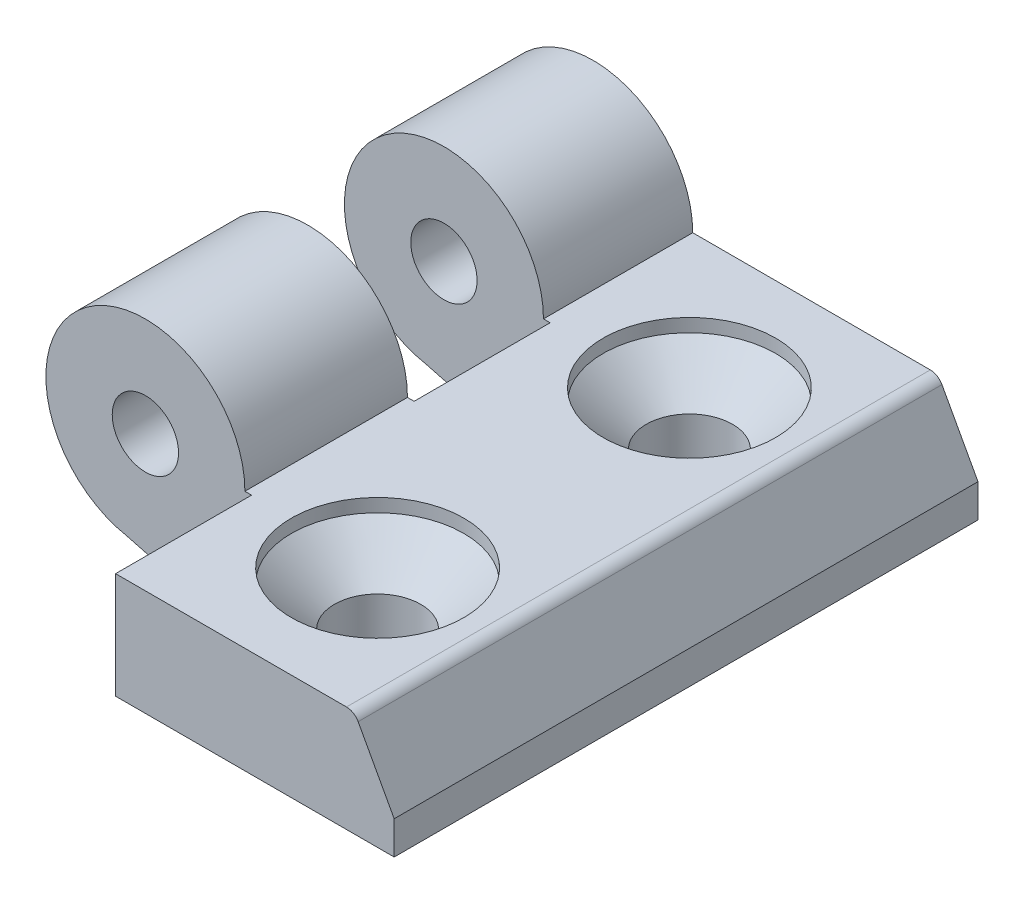
from build123d import *

# Parameters (mm, degrees)
EXTRUDE_1_DEPTH          = 22
PATTERN_LINEAR_1_COUNT   = 2
PATTERN_LINEAR_1_PITCH   = 23.5
CUT_EXTRUDE_1_DEPTH      = 38.269290307
CUT_EXTRUDE_1_DEPTH_BACK = 38.269290307
SKETCH_4_W               = 16.100903004
SKETCH_4_H               = 10.25
SKETCH_5_R               = 2.5
CUT_EXTRUDE_2_DEPTH      = 54.301031885


with BuildPart() as part:
    # 草图1 → 凸台-拉伸1 (new, symmetric)
    with BuildSketch(Plane.XY):
        with BuildLine():
            Line((29, -5.5), (29, -8))
            Line((29, -8), (1, -8))
            Line((1, -8), (-1.370141735, -7.373785434))
            ThreePointArc((-1.370141735, -7.373785434), (-4.794472702, 5.767411162), (7.5, 0))
            Line((7.5, 0), (25.406366901, 0))
            ThreePointArc((25.406366901, 0), (25.916831332, -0.140101131), (26.284262474, -0.521147869))
            Line((26.284262474, -0.521147869), (29, -5.5))
        make_face()
    extrude(amount=EXTRUDE_1_DEPTH, both=True)

    # 草图3 → 切除-旋转1 (revolve, cut)
    with BuildSketch(Plane.XY.offset(11.75), mode=Mode.PRIVATE) as cut_revolve_1_sk:
        Polygon((24, 0), (17.5, 0), (17.5, -8), (20.75, -8), (20.75, -4), (24, -1), align=None)
    cut_revolve_1 = revolve(cut_revolve_1_sk.sketch.rotate(Axis((17.5, -8, 11.75), (0, 1, 0)), 90), axis=Axis((17.5, -8, 11.75), (0, 1, 0)), mode=Mode.SUBTRACT)

    # 阵列(线性)1: 切除-旋转1 ×2
    with Locations(*[(0, 0, -i * PATTERN_LINEAR_1_PITCH) for i in range(1, PATTERN_LINEAR_1_COUNT)]):
        add(cut_revolve_1, mode=Mode.SUBTRACT)

    # 草图4 → 切除-拉伸1 (cut, two sides: drawn at the far end of the back side and taken through both)
    with BuildSketch(Plane(origin=(0, 0, 0), x_dir=(1, 0, 0), z_dir=(0, 1, 0)).offset(-CUT_EXTRUDE_1_DEPTH_BACK)):
        with Locations((-0.04685673, -16.875)):
            Rectangle(SKETCH_4_W, SKETCH_4_H)
        with Locations((-0.04685673, 5.625)):
            Rectangle(SKETCH_4_W, SKETCH_4_H)
    extrude(amount=CUT_EXTRUDE_1_DEPTH + CUT_EXTRUDE_1_DEPTH_BACK, mode=Mode.SUBTRACT)

    # 草图5 → 切除-拉伸2 (cut, through all)
    with BuildSketch(Plane(origin=(0, 0, -22), x_dir=(-1, 0, 0), z_dir=(0, 0, -1))):
        Circle(SKETCH_5_R)
    extrude(amount=-CUT_EXTRUDE_2_DEPTH, mode=Mode.SUBTRACT)


solid = part.part
